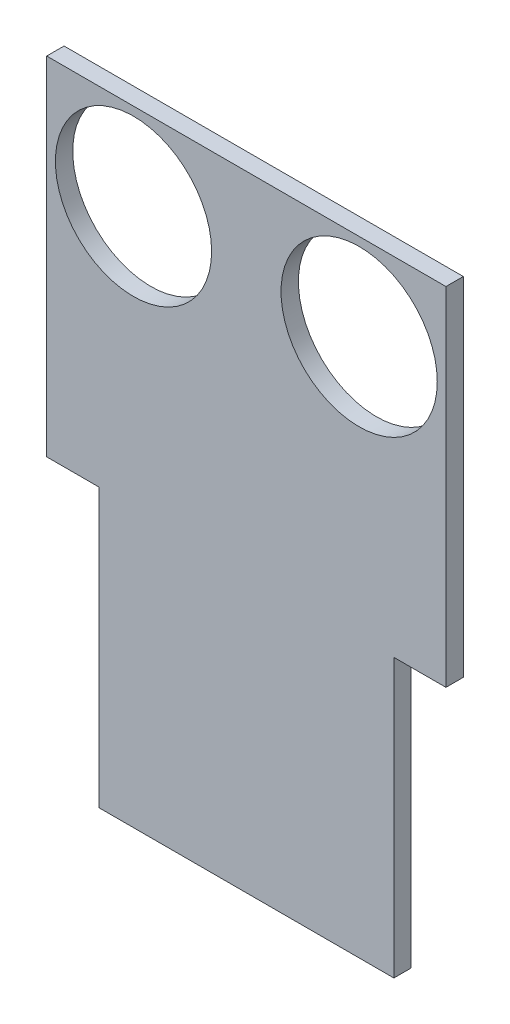
from build123d import *

# Parameters (mm, degrees)
SKETCH1_R           = 9
BOSS_EXTRUDE1_DEPTH = 2


with BuildPart() as part:
    # Sketch1 → Boss-Extrude1 (new body)
    with BuildSketch(Plane.XY):
        Polygon((-23, -4), (-17, -4), (-17, -36), (17, -36), (17, -4), (23, -4), (23, 36), (-23, 36), align=None)
        with Locations((-13, 26)):
            Circle(SKETCH1_R, mode=Mode.SUBTRACT)
        with Locations((13, 26)):
            Circle(SKETCH1_R, mode=Mode.SUBTRACT)
    extrude(amount=BOSS_EXTRUDE1_DEPTH)


solid = part.part
